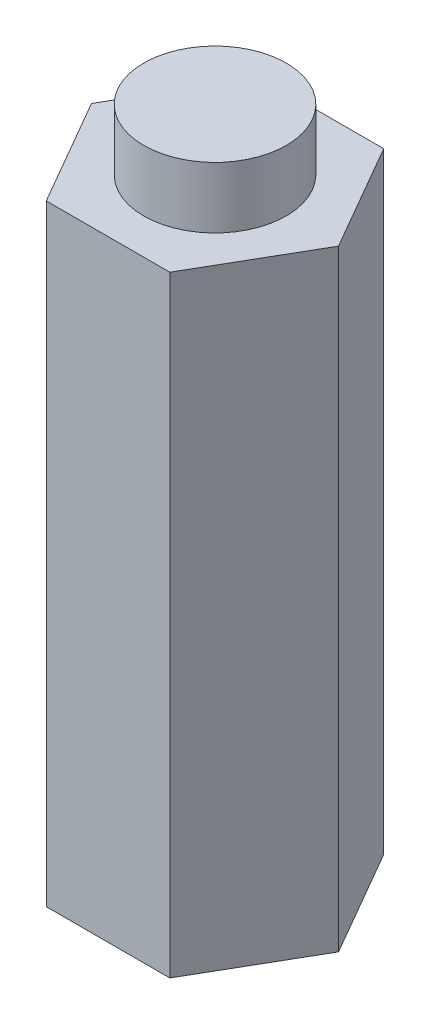
from build123d import *

# Parameters (mm, degrees)
SKETCH1_R           = 7
BOSS_EXTRUDE1_DEPTH = 60
SKETCH1_3_R         = 7
BOSS_EXTRUDE2_DEPTH = 66


with BuildPart() as part:
    # Sketch1 → Boss-Extrude1 (new body)
    with BuildSketch(Plane(origin=(0, 0, 0), x_dir=(1, 0, 0), z_dir=(0, 1, 0))):
        Polygon((12.124355653, 0), (6.062177826, 10.5), (-6.062177826, 10.5), (-12.124355653, 0), (-6.062177826, -10.5), (6.062177826, -10.5), align=None)
        Circle(SKETCH1_R, mode=Mode.SUBTRACT)
    extrude(amount=BOSS_EXTRUDE1_DEPTH)

    # Sketch1<3> → Boss-Extrude2 (add)
    with BuildSketch(Plane(origin=(0, 0, 0), x_dir=(1, 0, 0), z_dir=(0, 1, 0))):
        Circle(SKETCH1_3_R)
    extrude(amount=BOSS_EXTRUDE2_DEPTH)


solid = part.part
